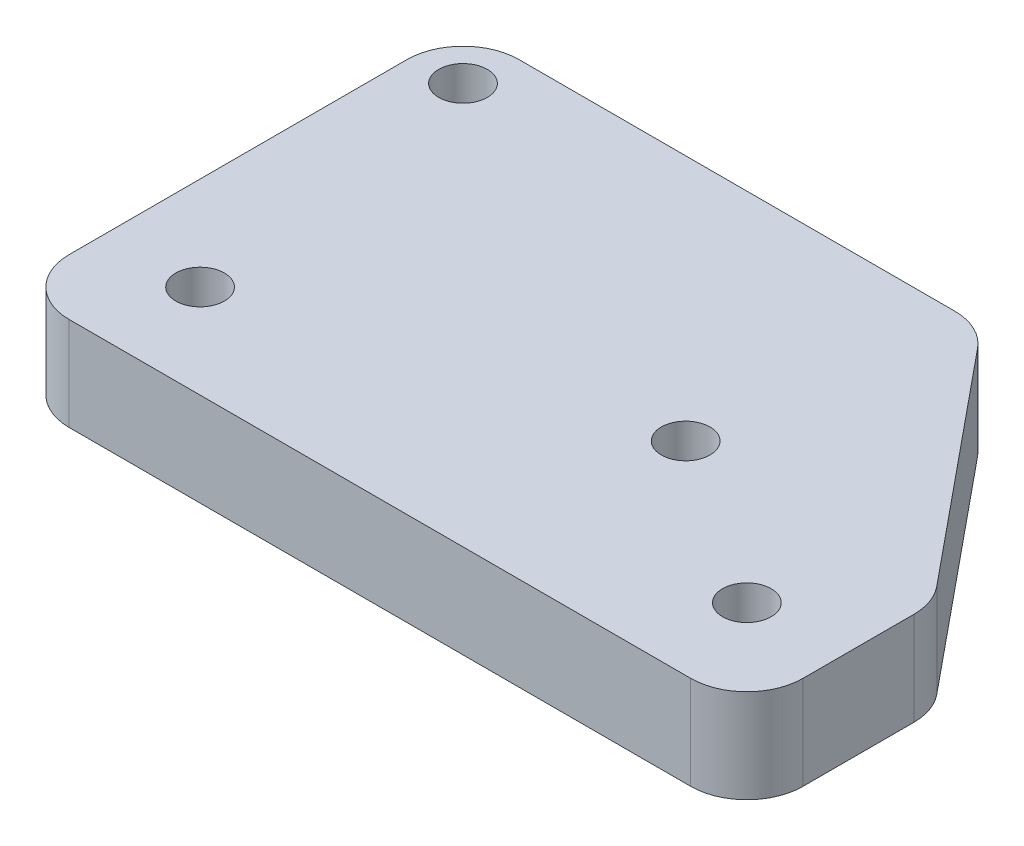
from build123d import *

# Parameters (mm, degrees)
SKETCH_1_W          = 27.7
SKETCH_1_H          = 15.8
EXTRUDE_1_DEPTH     = 5
SKETCH_2_R          = 1.3
CUT_EXTRUDE_1_DEPTH = 17.710251345
SKETCH_3_R          = 1.3
EXTRUDE_2_DEPTH     = 5
FILLET_1_R          = 3


with BuildPart() as part:
    # ｽｹｯﾁ1 → ﾎﾞｽ - 押し出し1 (new body)
    with BuildSketch(Plane(origin=(0, 0, 0), x_dir=(1, 0, 0), z_dir=(0, 1, 0))):
        Rectangle(SKETCH_1_W, SKETCH_1_H)
    extrude(amount=EXTRUDE_1_DEPTH)

    # ｽｹｯﾁ2 → ｶｯﾄ - 押し出し1 (cut, through all)
    with BuildSketch(Plane(origin=(0, 5, 0), x_dir=(1, 0, 0), z_dir=(0, 1, 0))):
        with Locations(Location((-11.25, 5.3, 0), (0, 0, 270))):
            Circle(SKETCH_2_R)
        with Locations(Location((11.25, -5.3, 0), (0, 0, 270))):
            Circle(SKETCH_2_R)
    extrude(amount=-CUT_EXTRUDE_1_DEPTH, mode=Mode.SUBTRACT)

    # ｽｹｯﾁ3 → ﾎﾞｽ - 押し出し2 (add)
    # profile 1 of 2: a face of its own
    with BuildSketch(Plane(origin=(0, 5, 0), x_dir=(1, 0, 0), z_dir=(0, 1, 0))):
        Polygon((25.37, -6.15), (13.85, -6.15), (13.85, -7.9), (-13.85, -7.9), (-13.85, -16.15), (25.37, -16.15), align=None)
        with Locations(Location((-8.85, -11.15, 0), (0, 0, 270))):
            Circle(SKETCH_3_R, mode=Mode.SUBTRACT)
        with Locations(Location((20.37, -11.15, 0), (0, 0, 270))):
            Circle(SKETCH_3_R, mode=Mode.SUBTRACT)
    # profile 2 of 2: a face of its own
    with BuildSketch(Plane(origin=(0, 5, 0), x_dir=(1, 0, 0), z_dir=(0, 1, 0))):
        Polygon((13.85, 7.9), (13.85, -6.15), (25.37, -6.15), align=None)
    extrude(amount=-EXTRUDE_2_DEPTH)

    # ﾌｨﾚｯﾄ1
    fillet_1_edges = [part.edges().sort_by_distance(p)[0] for p in [
        (-13.85, 2.5, 16.15),
        (25.37, 2.5, 16.15),
        (25.37, 2.5, 6.15),
        (-13.85, 2.5, -7.9),
        (13.85, 2.5, -7.9),
    ]]
    fillet(fillet_1_edges, radius=FILLET_1_R)


solid = part.part
